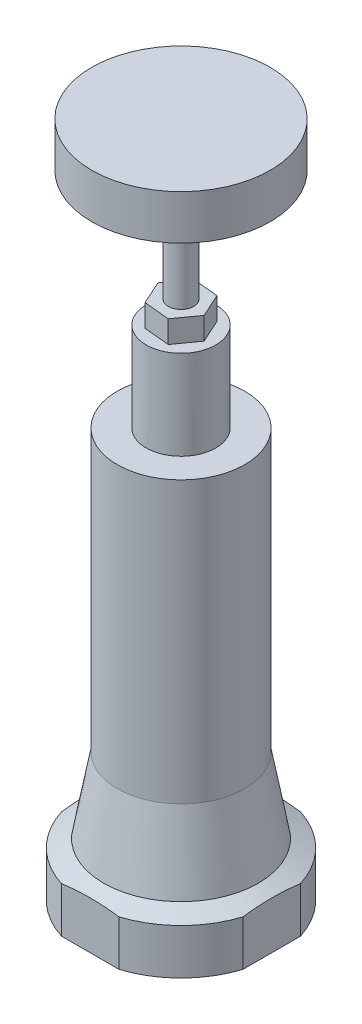
from build123d import *

# Parameters (mm, degrees)
SKETCH2_OUTSIDE_W   = 84.116
SKETCH2_OUTSIDE_H   = 84.116
SKETCH2_OUTSIDE_W_2 = 51.689
SKETCH2_OUTSIDE_H_2 = 51.689
EXTRUDE1_DEPTH      = 17.78
SKETCH3_R           = 9.906
EXTRUDE2_DEPTH      = 25.4
EXTRUDE3_DEPTH      = 6.35
SKETCH5_R           = 3.6195
EXTRUDE4_DEPTH      = 12.7
SKETCH6_R           = 3.6195
EXTRUDE5_DEPTH      = 31.75
SKETCH7_R           = 25.4
EXTRUDE6_DEPTH      = 12.7


with BuildPart() as part:
    # Sketch1 → Revolve1 (revolve)
    with BuildSketch(Plane.XY, mode=Mode.PRIVATE) as revolve1_sk:
        Polygon((0, 0), (-18.1356, 0), (-18.1356, -79.883), (-22.0345, -101.219), (-27.1145, -103.505), (-27.1145, -116.459), (0, -116.459), align=None)
    revolve(revolve1_sk.sketch.rotate(Axis((0, -116.459, 0), (0, 1, 0)), 270), axis=Axis((0, -116.459, 0), (0, 1, 0)))

    # Sketch2 outside → Extrude1 (cut)
    with BuildSketch(Plane.XZ.offset(116.459)):
        Rectangle(SKETCH2_OUTSIDE_W, SKETCH2_OUTSIDE_H)
        Rectangle(SKETCH2_OUTSIDE_W_2, SKETCH2_OUTSIDE_H_2, mode=Mode.SUBTRACT)
    extrude(amount=-EXTRUDE1_DEPTH, mode=Mode.SUBTRACT)

    # Sketch3 → Extrude2 (add)
    with BuildSketch(Plane(origin=(0, 0, 0), x_dir=(1, 0, 0), z_dir=(0, 1, 0))):
        with Locations(Location((0, 0, 0), (0, 0, 90))):
            Circle(SKETCH3_R)
    extrude(amount=EXTRUDE2_DEPTH)

    # Sketch4 → Extrude3 (add)
    with BuildSketch(Plane(origin=(0, 25.4, 0), x_dir=(1, 0, 0), z_dir=(0, 1, 0))):
        Polygon((-4.265485733, -5.963972233), (3.032208595, -6.676005121), (7.297694328, -0.712032888), (4.265485733, 5.963972233), (-3.032208595, 6.676005121), (-7.297694328, 0.712032888), align=None)
    extrude(amount=EXTRUDE3_DEPTH)

    # Sketch5 → Extrude4 (cut)
    with BuildSketch(Plane(origin=(0, 31.75, 0), x_dir=(1, 0, 0), z_dir=(0, 1, 0))):
        with Locations(Location((0, 0, 0), (0, 0, 270))):
            Circle(SKETCH5_R)
    extrude(amount=-EXTRUDE4_DEPTH, mode=Mode.SUBTRACT)


with BuildPart() as body_2:
    # Sketch6 → Extrude5 (new body)
    with BuildSketch(Plane(origin=(0, 31.75, 0), x_dir=(1, 0, 0), z_dir=(0, 1, 0))):
        with Locations(Location((0, 0, 0), (0, 0, 270))):
            Circle(SKETCH6_R)
    extrude(amount=EXTRUDE5_DEPTH)

    # Sketch7 → Extrude6 (add)
    with BuildSketch(Plane(origin=(0, 63.5, 0), x_dir=(1, 0, 0), z_dir=(0, 1, 0))):
        with Locations(Location((0, 0, 0), (0, 0, 270))):
            Circle(SKETCH7_R)
    extrude(amount=EXTRUDE6_DEPTH)


solid = Compound([part.part, body_2.part])
